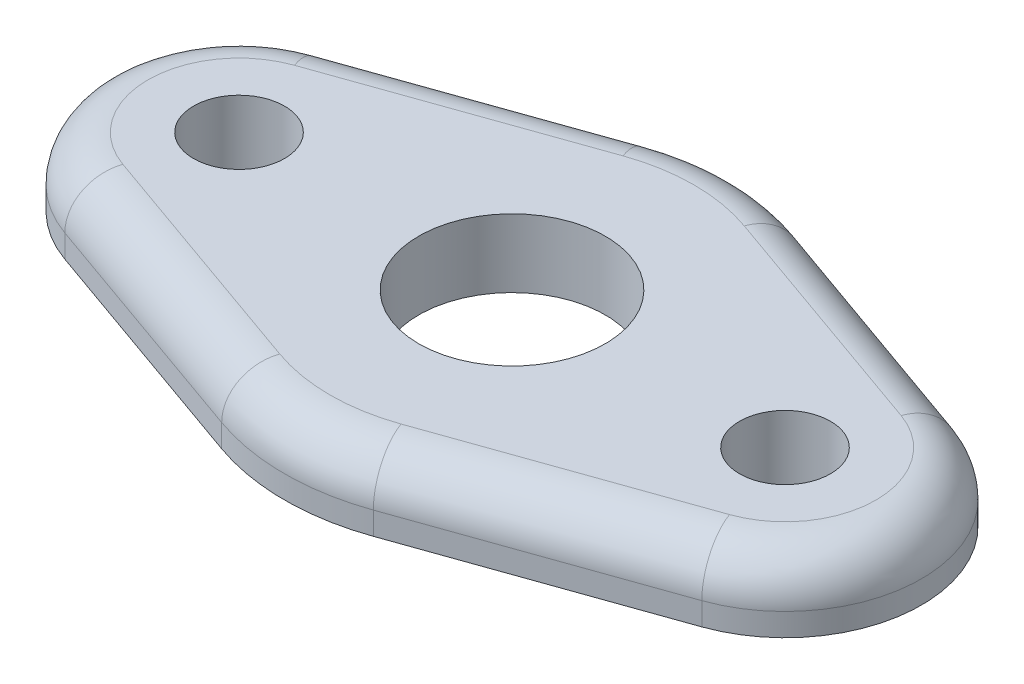
from build123d import *

# Parameters (mm, degrees)
SKETCH1_R           = 4.1
SKETCH1_R_2         = 2
BOSS_EXTRUDE1_DEPTH = 3
FILLET1_R           = 2


with BuildPart() as part:
    # Sketch1 → Boss-Extrude1 (new body)
    with BuildSketch(Plane(origin=(0, 0, 0), x_dir=(1, 0, 0), z_dir=(0, 1, 0))):
        with BuildLine():
            Line((-14, 5.656854249), (-3.333333333, 9.428090416))
            ThreePointArc((-3.333333333, 9.428090416), (0, 10), (3.333333333, 9.428090416))
            Line((3.333333333, 9.428090416), (14, 5.656854249))
            ThreePointArc((14, 5.656854249), (18, 0), (14, -5.656854249))
            Line((14, -5.656854249), (3.333333333, -9.428090416))
            ThreePointArc((3.333333333, -9.428090416), (0, -10), (-3.333333333, -9.428090416))
            Line((-3.333333333, -9.428090416), (-14, -5.656854249))
            ThreePointArc((-14, -5.656854249), (-18, 0), (-14, 5.656854249))
        make_face()
        with Locations(Location((0, 0, 0), (0, 0, 270))):
            Circle(SKETCH1_R, mode=Mode.SUBTRACT)
        with Locations(Location((-12, 0, 0), (0, 0, 270))):
            Circle(SKETCH1_R_2, mode=Mode.SUBTRACT)
        with Locations(Location((12, 0, 0), (0, 0, 270))):
            Circle(SKETCH1_R_2, mode=Mode.SUBTRACT)
    extrude(amount=BOSS_EXTRUDE1_DEPTH)

    # Fillet1
    fillet1_edges = [part.edges().sort_by_distance(p)[0] for p in [
        (0, 3, 10),
        (8.666666667, 3, 7.542472333),
        (18, 3, 0),
        (8.666666667, 3, -7.542472333),
        (0, 3, -10),
        (-8.666666667, 3, -7.542472333),
        (-18, 3, 0),
        (-8.666666667, 3, 7.542472333),
    ]]
    fillet(fillet1_edges, radius=FILLET1_R)


solid = part.part
